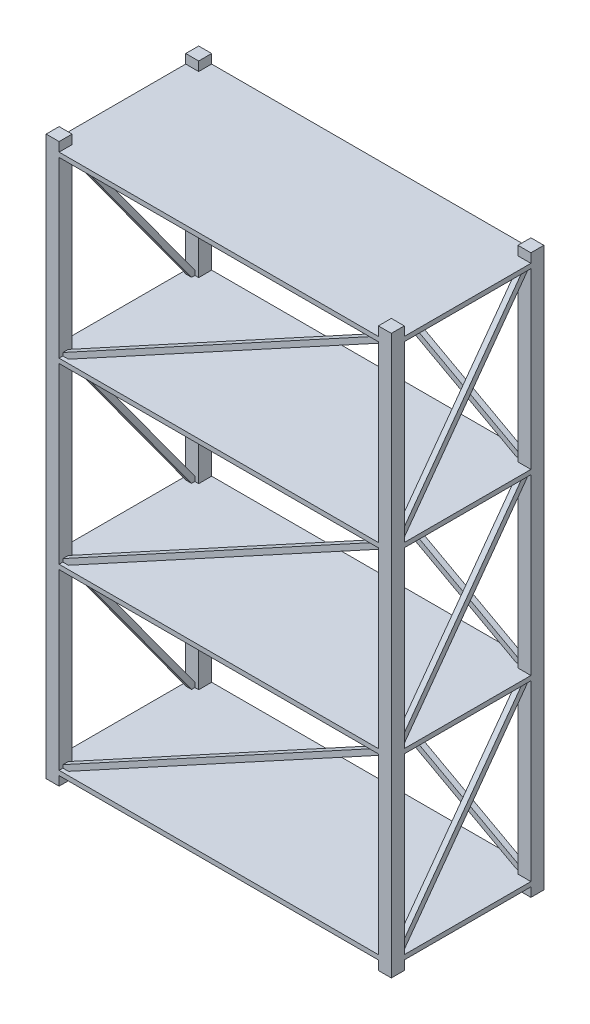
from build123d import *

# Parameters (mm, degrees)
SKETCH2_W           = 226.3
SKETCH2_H           = 100
BOSS_EXTRUDE1_DEPTH = 183
SKETCH4_OUTSIDE_W   = 316.656
SKETCH4_OUTSIDE_H   = 190.356
SKETCH4_OUTSIDE_W_2 = 8.5
SKETCH4_OUTSIDE_H_2 = 8.5
CUT_EXTRUDE1_DEPTH  = 6
SKETCH5_W           = 209.3
SKETCH5_H           = 114
CUT_EXTRUDE2_DEPTH  = 238.259188442
SKETCH6_W           = 83
SKETCH6_H           = 114
CUT_EXTRUDE3_DEPTH  = 296.29762952
EXTRUDE_THIN1_START = -2.5
EXTRUDE_THIN1_DEPTH = 3.5
EXTRUDE_THIN2_START = -2.5
EXTRUDE_THIN2_DEPTH = 3.5
CIRPATTERN1_COUNT   = 2


with BuildPart() as part:
    # Sketch2 → Boss-Extrude1 (new, symmetric)
    with BuildSketch(Plane(origin=(0, 0, 0), x_dir=(1, 0, 0), z_dir=(0, 1, 0))):
        Rectangle(SKETCH2_W, SKETCH2_H)
    extrude(amount=BOSS_EXTRUDE1_DEPTH, both=True)

    # Sketch4 outside → Cut-Extrude1 (cut)
    with BuildSketch(Plane.XZ.offset(183)):
        Rectangle(SKETCH4_OUTSIDE_W, SKETCH4_OUTSIDE_H)
        with Locations((-108.9, 45.75)):
            Rectangle(SKETCH4_OUTSIDE_W_2, SKETCH4_OUTSIDE_H_2, mode=Mode.SUBTRACT)
        with Locations((-108.9, -45.75)):
            Rectangle(SKETCH4_OUTSIDE_W_2, SKETCH4_OUTSIDE_H_2, mode=Mode.SUBTRACT)
        with Locations((108.9, -45.75)):
            Rectangle(SKETCH4_OUTSIDE_W_2, SKETCH4_OUTSIDE_H_2, mode=Mode.SUBTRACT)
        with Locations((108.9, 45.75)):
            Rectangle(SKETCH4_OUTSIDE_W_2, SKETCH4_OUTSIDE_H_2, mode=Mode.SUBTRACT)
    cut_extrude1 = extrude(amount=-CUT_EXTRUDE1_DEPTH, mode=Mode.SUBTRACT)

    # Mirror1: Cut-Extrude1 across plane
    add(cut_extrude1.mirror(Plane.ZX), mode=Mode.SUBTRACT)

    # Sketch5 → Cut-Extrude2 (cut, through all)
    with BuildSketch(Plane.XY.offset(50)):
        with Locations((0, 117)):
            Rectangle(SKETCH5_W, SKETCH5_H)
        with Locations((0, -117)):
            Rectangle(SKETCH5_W, SKETCH5_H)
        Rectangle(SKETCH5_W, SKETCH5_H)
    extrude(amount=-CUT_EXTRUDE2_DEPTH, mode=Mode.SUBTRACT)

    # Sketch6 → Cut-Extrude3 (cut, through all)
    with BuildSketch(Plane(origin=(113.15, 0, 0), x_dir=(0, 0, -1), z_dir=(1, 0, 0))):
        with Locations((0, 117)):
            Rectangle(SKETCH6_W, SKETCH6_H)
        with Locations((0, -117)):
            Rectangle(SKETCH6_W, SKETCH6_H)
        Rectangle(SKETCH6_W, SKETCH6_H)
    extrude(amount=-CUT_EXTRUDE3_DEPTH, mode=Mode.SUBTRACT)

    # Sketch7 → Extrude-Thin1 (add)
    with BuildSketch(Plane.XY.offset(50).offset(EXTRUDE_THIN1_START)):
        Polygon((-103.812934943, -175.536822075), (105.487065057, -61.536822075), (103.812934943, -58.463177925), (-105.487065057, -172.463177925), align=None)
        Polygon((-103.812934943, -58.536822075), (105.487065057, 55.463177925), (103.812934943, 58.536822075), (-105.487065057, -55.463177925), align=None)
        Polygon((-103.812934943, 58.463177925), (105.487065057, 172.463177925), (103.812934943, 175.536822075), (-105.487065057, 61.536822075), align=None)
    extrude_thin1 = extrude(amount=-EXTRUDE_THIN1_DEPTH)

    # Sketch8 → Extrude-Thin2 (add)
    with BuildSketch(Plane(origin=(113.15, 0, 0), x_dir=(0, 0, -1), z_dir=(1, 0, 0)).offset(EXTRUDE_THIN2_START)):
        Polygon((-40.085248698, -175.030038229), (42.914751302, -61.030038229), (40.085248698, -58.969961771), (-42.914751302, -172.969961771), align=None)
        Polygon((-40.085248698, -58.030038229), (42.914751302, 55.969961771), (40.085248698, 58.030038229), (-42.914751302, -55.969961771), align=None)
        Polygon((-40.085248698, 58.969961771), (42.914751302, 172.969961771), (40.085248698, 175.030038229), (-42.914751302, 61.030038229), align=None)
    extrude_thin2 = extrude(amount=-EXTRUDE_THIN2_DEPTH)

    # CirPattern1: Extrude-Thin1, Extrude-Thin2 ×2 about axis
    cirpattern1_axis = Axis((0, -201.3, 0), (0, 1, 0))
    add([extrude_thin1.rotate(cirpattern1_axis, i * 360 / CIRPATTERN1_COUNT) for i in range(1, CIRPATTERN1_COUNT)])
    add([extrude_thin2.rotate(cirpattern1_axis, i * 360 / CIRPATTERN1_COUNT) for i in range(1, CIRPATTERN1_COUNT)])


solid = part.part
